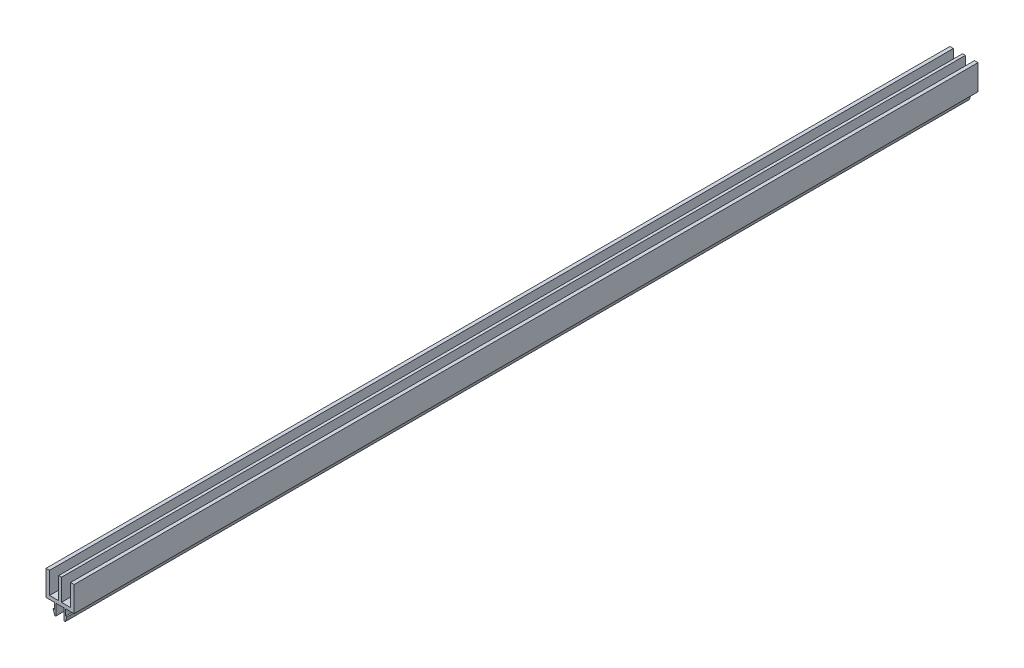
from build123d import *

# Parameters (mm, degrees)
BOSS_EXTRU_1_DEPTH = 644


with BuildPart() as part:
    # Esquisse1 → Boss.-Extru.1 (new body)
    with BuildSketch(Plane.XY.offset(50)):
        Polygon((-1, 2.5), (-7.5, 2.5), (-7.5, 17.999999998), (-10, 17.999999998), (-10, 0), (-4, 0), (-4, -4.5), (-5, -4.5), (-3.75, -8), (-3, -8), (-3, 0), (3, 0), (3, -8), (3.75, -8), (5, -4.5), (4, -4.5), (4, 0), (10, 0), (10, 17.999999998), (7.5, 17.999999998), (7.5, 2.5), (1, 2.5), (1, 17.999999998), (-1, 17.999999998), align=None)
    extrude(amount=-BOSS_EXTRU_1_DEPTH)


solid = part.part
